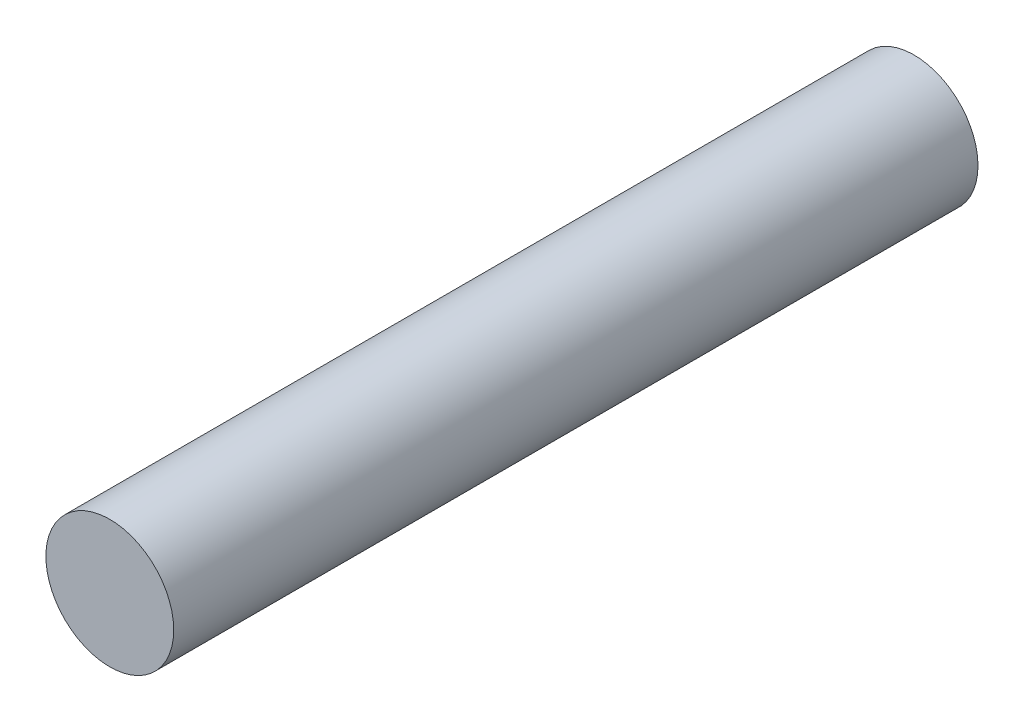
from build123d import *

# Parameters (mm, degrees)
SKETCH2_R           = 119.212160282
BOSS_EXTRUDE1_DEPTH = 1500


with BuildPart() as part:
    # Sketch2 → Boss-Extrude1 (new body)
    with BuildSketch(Plane.XY):
        Circle(SKETCH2_R)
    extrude(amount=BOSS_EXTRUDE1_DEPTH)


solid = part.part
